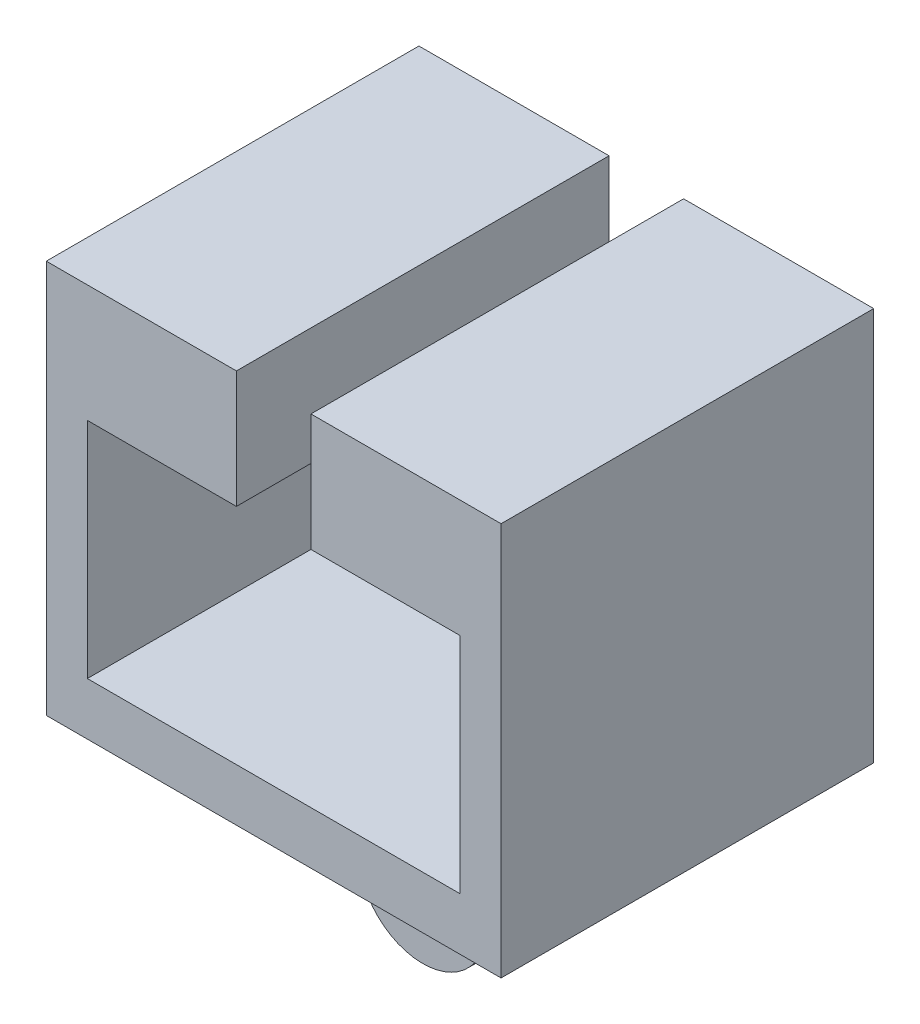
from build123d import *

# Parameters (mm, degrees)
SKETCH1_R           = 10.89504564
BOSS_EXTRUDE1_DEPTH = 38.1
SKETCH2_W           = 22.352
SKETCH2_H           = 19.05
BOSS_EXTRUDE2_DEPTH = 2.44693827
SKETCH3_W           = 63.5
SKETCH3_H           = 8.943070636
BOSS_EXTRUDE3_DEPTH = 63.5
BOSS_EXTRUDE4_DEPTH = 63.5


with BuildPart() as part:
    # Sketch1 → Boss-Extrude1 (new body)
    with BuildSketch(Plane.XY):
        Circle(SKETCH1_R)
    extrude(amount=-BOSS_EXTRUDE1_DEPTH)

    # Sketch2 → Boss-Extrude2 (add)
    with BuildSketch(Plane(origin=(0, 0, -38.1), x_dir=(-1, 0, 0), z_dir=(0, 0, -1))):
        with Locations((0, 9.525)):
            Rectangle(SKETCH2_W, SKETCH2_H)
    extrude(amount=-BOSS_EXTRUDE2_DEPTH)

    # Sketch3 → Boss-Extrude3 (add)
    with BuildSketch(Plane(origin=(0, 0, -38.1), x_dir=(-1, 0, 0), z_dir=(0, 0, -1))):
        with Locations((0, 23.521535318)):
            Rectangle(SKETCH3_W, SKETCH3_H)
    extrude(amount=-BOSS_EXTRUDE3_DEPTH)

    # Sketch4 → Boss-Extrude4 (add)
    with BuildSketch(Plane(origin=(0, 0, -38.1), x_dir=(-1, 0, 0), z_dir=(0, 0, -1))):
        Polygon((-31.75, 27.993070636), (-31.75, 66.093070636), (-6.35, 66.093070636), (-6.35, 86.090384505), (-38.747245179, 86.090384505), (-38.747245179, 19.05), (-31.75, 19.05), align=None)
        Polygon((31.75, 27.993070636), (31.75, 66.093070636), (6.35, 66.093070636), (6.35, 86.090384505), (38.747245179, 86.090384505), (38.747245179, 19.05), (31.75, 19.05), align=None)
    extrude(amount=-BOSS_EXTRUDE4_DEPTH)


solid = part.part
